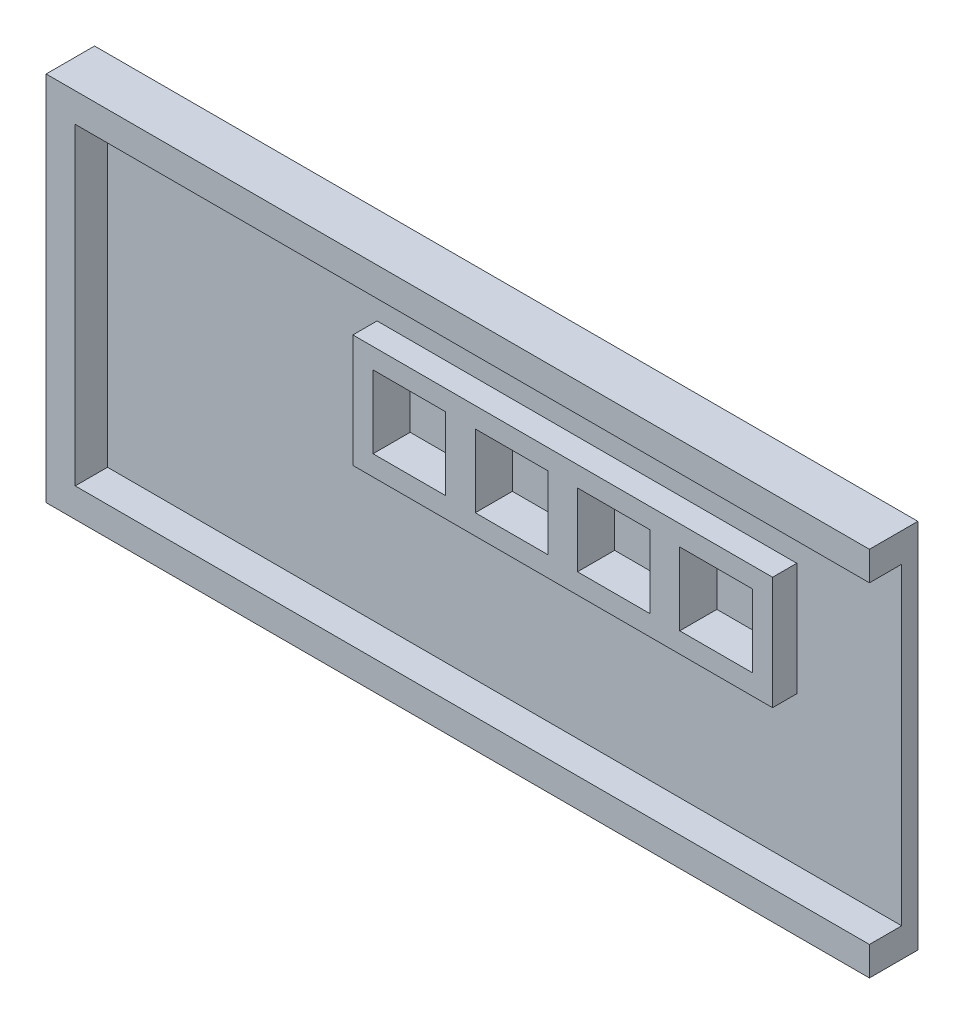
from build123d import *

# Parameters (mm, degrees)
SKETCH1_W           = 51
SKETCH1_H           = 23
BOSS_EXTRUDE1_DEPTH = 1
BOSS_EXTRUDE2_DEPTH = 2
SKETCH3_W           = 26
SKETCH3_H           = 7
BOSS_EXTRUDE3_DEPTH = 1.5
SKETCH4_W           = 4.5
SKETCH4_H           = 4.5
CUT_EXTRUDE1_DEPTH  = 2.3


with BuildPart() as part:
    # Sketch1 → Boss-Extrude1 (new body)
    with BuildSketch(Plane.XY):
        with Locations((-25.5, 11.5)):
            Rectangle(SKETCH1_W, SKETCH1_H)
    extrude(amount=BOSS_EXTRUDE1_DEPTH)

    # Sketch2 → Boss-Extrude2 (add)
    with BuildSketch(Plane.XY.offset(1)):
        Polygon((-51, 23), (0, 23), (0, 21.2), (-49.2, 21.2), (-49.2, 1.8), (0, 1.8), (0, 0), (-51, 0), (-51, 1.8), (-51, 21.2), align=None)
    extrude(amount=BOSS_EXTRUDE2_DEPTH)

    # Sketch3 → Boss-Extrude3 (add)
    with BuildSketch(Plane.XY.offset(1)):
        with Locations((-19.5, 14.5)):
            Rectangle(SKETCH3_W, SKETCH3_H)
    extrude(amount=BOSS_EXTRUDE3_DEPTH)

    # Sketch4 → Cut-Extrude1 (cut)
    with BuildSketch(Plane.XY.offset(2.5)):
        with Locations((-29, 14.5)):
            Rectangle(SKETCH4_W, SKETCH4_H)
        with Locations((-22.666666667, 14.5)):
            Rectangle(SKETCH4_W, SKETCH4_H)
        with Locations((-16.333333333, 14.5)):
            Rectangle(SKETCH4_W, SKETCH4_H)
        with Locations((-10, 14.5)):
            Rectangle(SKETCH4_W, SKETCH4_H)
    extrude(amount=-CUT_EXTRUDE1_DEPTH, mode=Mode.SUBTRACT)


solid = part.part
